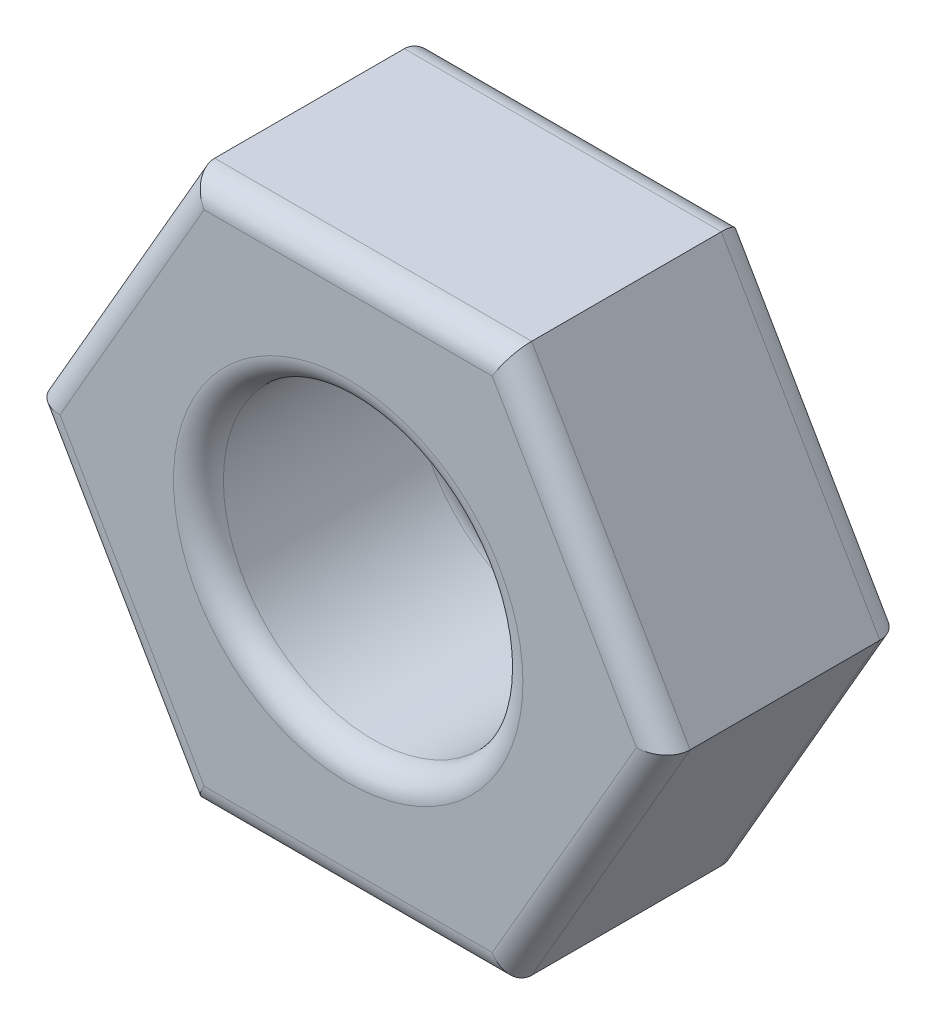
from build123d import *

# Parameters (mm, degrees)
SKETCH_1_R      = 1.5
EXTRUDE_1_DEPTH = 2.4
FILLET_1_R      = 0.25


with BuildPart() as part:
    # Эскиз1 → Бобышка-Вытянуть1 (new body)
    with BuildSketch(Plane.XY):
        Polygon((1.58771324, 2.75), (-1.58771324, 2.75), (-3.175426481, 0), (-1.58771324, -2.75), (1.58771324, -2.75), (3.175426481, 0), align=None)
        Circle(SKETCH_1_R, mode=Mode.SUBTRACT)
    extrude(amount=EXTRUDE_1_DEPTH)

    # Скругление1
    fillet_1_edges = [part.edges().sort_by_distance(p)[0] for p in [
        (-2.38156986, 1.375, 2.4),
        (-2.38156986, -1.375, 2.4),
        (-1.5, 0, 0),
        (-1.5, 0, 2.4),
        (0, -2.75, 2.4),
        (2.38156986, -1.375, 2.4),
        (2.38156986, 1.375, 2.4),
        (2.38156986, -1.375, 0),
        (0, -2.75, 0),
        (-2.38156986, -1.375, 0),
        (-2.38156986, 1.375, 0),
        (0, 2.75, 0),
        (2.38156986, 1.375, 0),
        (0, 2.75, 2.4),
    ]]
    fillet(fillet_1_edges, radius=FILLET_1_R)


solid = part.part
